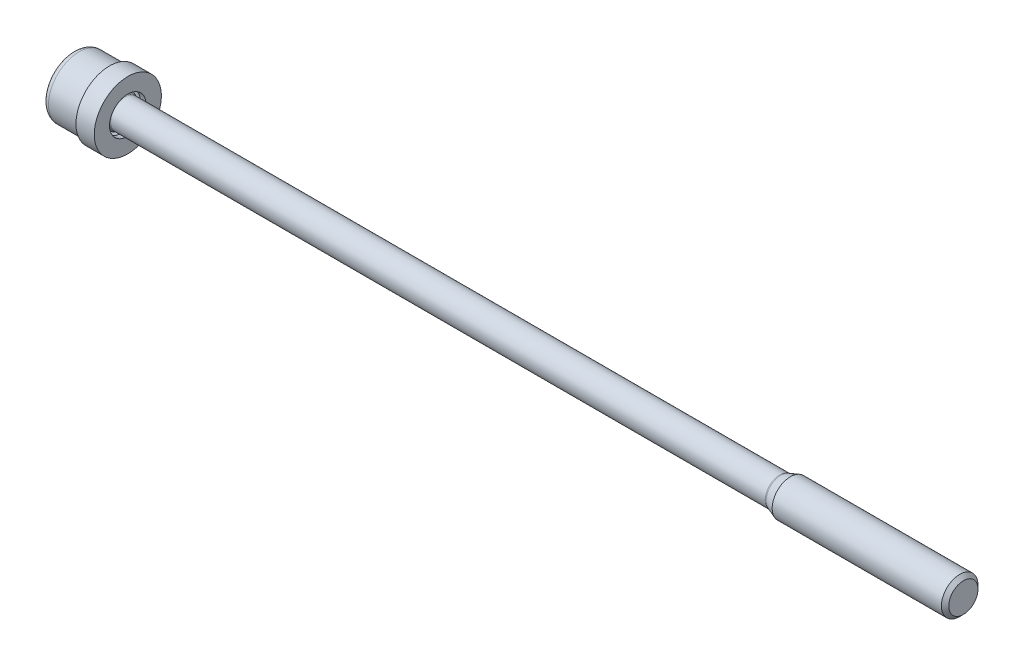
from build123d import *

# Parameters (mm, degrees)
AUFSATZ_LINEAR_AUSTRAGEN1_REACH = 148.171
SKIZZE2_R                       = 3
VERRUNDUNG1_R                   = 1
VERRUNDUNG2_R                   = 0.5


with BuildPart() as part:
    # Skizze1 → Rotation1 (revolve)
    with BuildSketch(Plane.XY, mode=Mode.PRIVATE) as rotation1_sk:
        Polygon((0, 5), (6, 5), (6, 3.309925586), (8.5, 2.4), (116, 2.4), (117.648486452, 3), (145.4, 3), (146, 2.4), (146, 0), (4.732050808, 0), (3, 3), (0, 3), align=None)
    revolve(rotation1_sk.sketch.rotate(Axis((0, 0, 0), (-1, 0, 0)), 90), axis=Axis((0, 0, 0), (-1, 0, 0)))

    # Aufsatz-Linear austragen1: up to this cone (the profile starts inside it)
    aufsatz_linear_austragen1_end = Plane(origin=(0, 0, 0), z_dir=(-1, 0, 0)).offset(-4.732049808) * Cone(1.732e-06, 279.898030457, 161.59920223, align=(Align.CENTER, Align.CENTER, Align.MIN), mode=Mode.PRIVATE)
    # Skizze2 → Aufsatz-Linear austragen1 (add, up to the surface)
    with BuildSketch(Plane.ZY, mode=Mode.PRIVATE) as aufsatz_linear_austragen1_sk1:
        with Locations(Location((0, 0, 0), (0, 0, 180))):
            Circle(SKIZZE2_R)
        Polygon((-2.886751346, 0), (-1.443375673, -2.5), (1.443375673, -2.5), (2.886751346, 0), (1.443375673, 2.5), (-1.443375673, 2.5), align=None, mode=Mode.SUBTRACT)
    aufsatz_linear_austragen1_tool1 = extrude(aufsatz_linear_austragen1_sk1.sketch, amount=-AUFSATZ_LINEAR_AUSTRAGEN1_REACH, mode=Mode.PRIVATE) & aufsatz_linear_austragen1_end
    add(aufsatz_linear_austragen1_tool1.solids().sort_by_distance((0, 0, 2.915147))[0])

    # Verrundung1
    verrundung1_edges = [part.edges().sort_by_distance(p)[0] for p in [
        (0, 0, 5),
    ]]
    fillet(verrundung1_edges, radius=VERRUNDUNG1_R)

    # Verrundung2
    verrundung2_edges = [part.edges().sort_by_distance(p)[0] for p in [
        (116, 0, 2.4),
        (8.5, 0, 2.4),
        (6, 0, 3.309925586),
    ]]
    fillet(verrundung2_edges, radius=VERRUNDUNG2_R)


with BuildPart() as body_2:
    # Skizze3 → Rotation2 (revolve)
    with BuildSketch(Plane.XY, mode=Mode.PRIVATE) as rotation2_sk:
        Polygon((6, 5.5), (9, 5.5), (9, 3), (8.060608065, 3), (6, 3.75), align=None)
    revolve(rotation2_sk.sketch.rotate(Axis((0, 0, 0), (1, 0, 0)), 90), axis=Axis((0, 0, 0), (1, 0, 0)))


solid = Compound([part.part, body_2.part])
